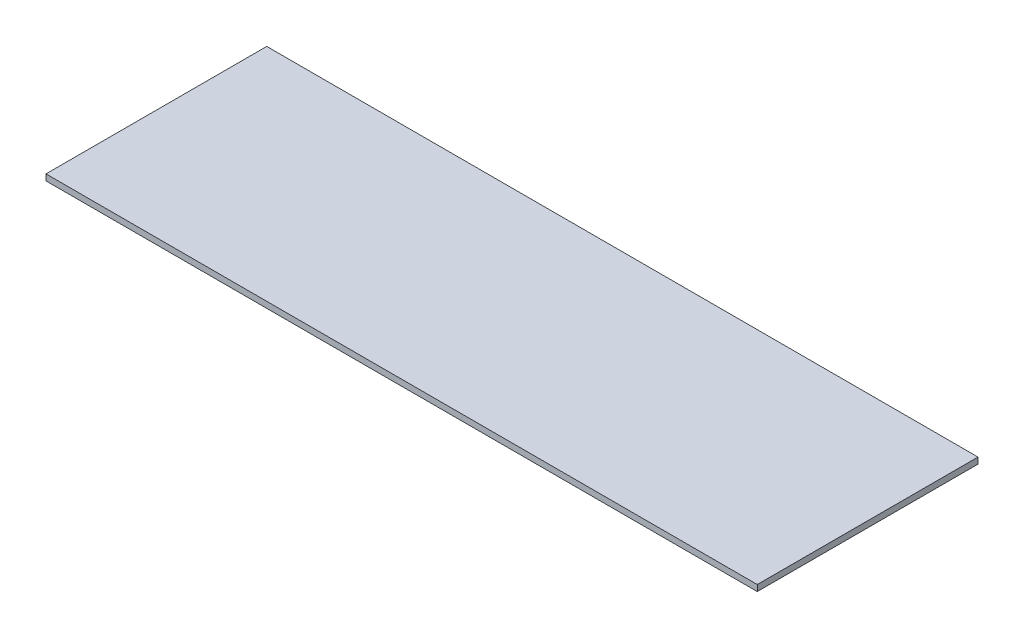
from build123d import *

# Parameters (mm, degrees)
SKETCH_1_W      = 580
SKETCH_1_H      = 180
EXTRUDE_1_DEPTH = 5


with BuildPart() as part:
    # Эскиз1 → Бобышка-Вытянуть1 (new body)
    with BuildSketch(Plane(origin=(0, 0, 0), x_dir=(1, 0, 0), z_dir=(0, 1, 0))):
        with Locations((290, 90)):
            Rectangle(SKETCH_1_W, SKETCH_1_H)
    extrude(amount=EXTRUDE_1_DEPTH)


solid = part.part
